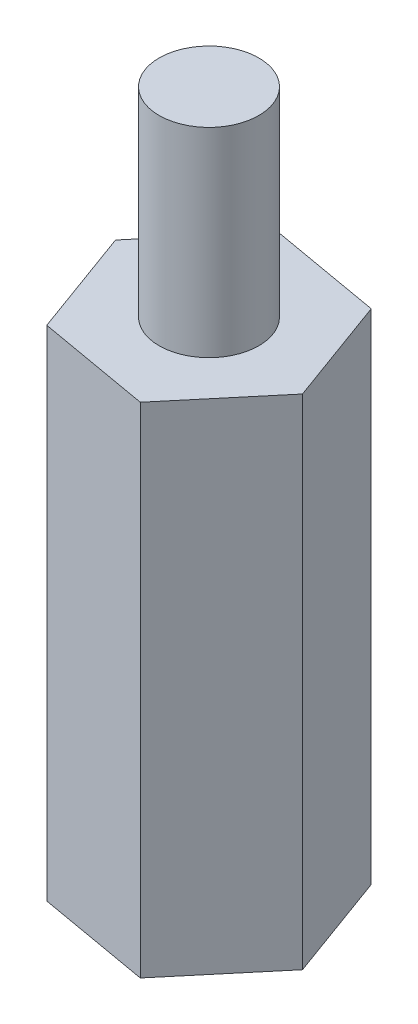
from build123d import *

# Parameters (mm, degrees)
EXTRUDE_1_DEPTH = 15
SKETCH_2_R      = 1.5
EXTRUDE_2_DEPTH = 6


with BuildPart() as part:
    # 草图1 → 凸台-拉伸1 (new body)
    with BuildSketch(Plane(origin=(0, 0, 0), x_dir=(1, 0, 0), z_dir=(0, 1, 0))):
        Polygon((1.187196382, -3.25431479), (3.411917471, -0.599015168), (2.224721088, 2.655299621), (-1.187196382, 3.25431479), (-3.411917471, 0.599015168), (-2.224721088, -2.655299621), align=None)
    extrude(amount=EXTRUDE_1_DEPTH)

    # 草图2 → 凸台-拉伸2 (add)
    with BuildSketch(Plane(origin=(0, 15, 0), x_dir=(1, 0, 0), z_dir=(0, 1, 0))):
        with Locations(Location((0, 0, 0), (0, 0, 270))):
            Circle(SKETCH_2_R)
    extrude(amount=EXTRUDE_2_DEPTH)


solid = part.part
